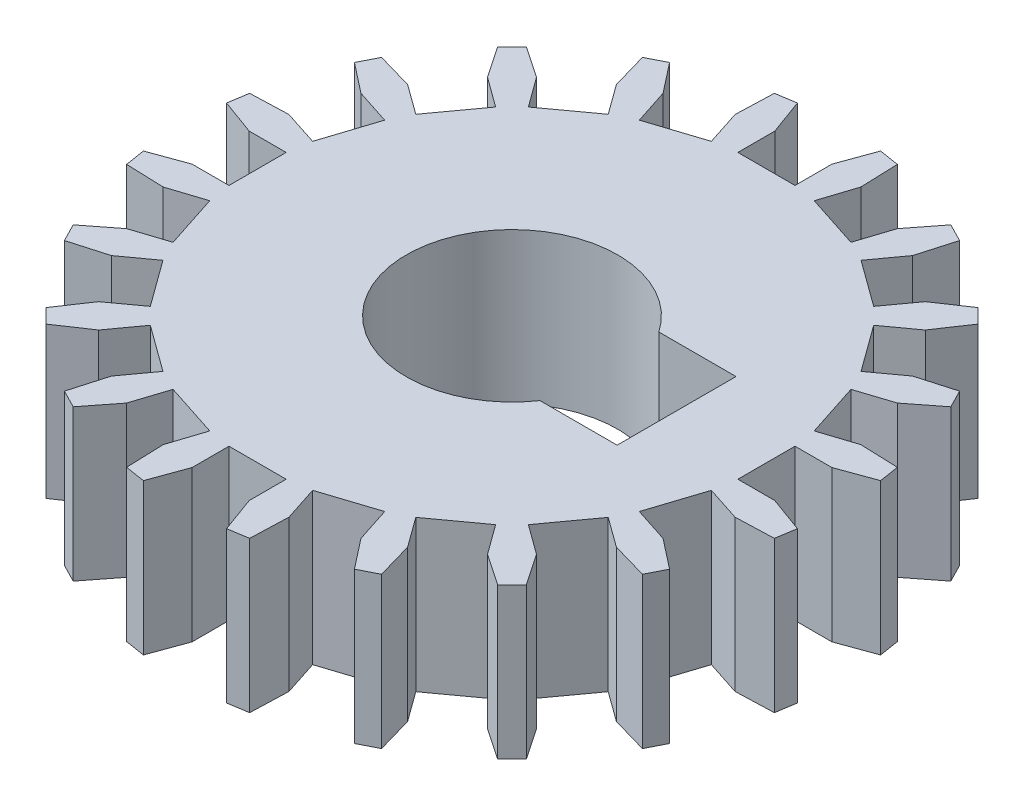
from build123d import *

# Parameters (mm, degrees)
SKETCH_1_R               = 25
EXTRUDE_1_DEPTH          = 10
CUT_EXTRUDE_1_DEPTH      = 37.742346142
PATTERN_CIRCULAR_1_COUNT = 20
CUT_EXTRUDE_2_DEPTH      = 37.334492668
PATTERN_CIRCULAR_2_COUNT = 20


with BuildPart() as part:
    # 草图1 → 凸台-拉伸1 (new body)
    with BuildSketch(Plane(origin=(0, 0, 0), x_dir=(1, 0, 0), z_dir=(0, 1, 0))):
        with Locations(Location((0, 0, 0), (0, 0, 270))):
            Circle(SKETCH_1_R)
        with BuildLine():
            Line((5.788177086, 3.936623684), (10.900331071, 3.936623684))
            Line((10.900331071, 3.936623684), (10.900331071, -3.936623684))
            Line((10.900331071, -3.936623684), (5.788177086, -3.936623684))
            ThreePointArc((5.788177086, -3.936623684), (-7, 0), (5.788177086, 3.936623684))
        make_face(mode=Mode.SUBTRACT)
    extrude(amount=EXTRUDE_1_DEPTH)

    # 草图2 → 切除-拉伸1 (cut, symmetric)
    with BuildSketch(Plane(origin=(0, 10, 0), x_dir=(1, 0, 0), z_dir=(0, 1, 0))):
        Polygon((-1.89299605, 16.850353612), (1.89299605, 16.850353612), (1.89299605, 19.294888065), (6.011008964, 30.60903556), (-6.011008964, 30.60903556), (-1.89299605, 19.294888065), align=None)
    cut_extrude_1 = extrude(amount=CUT_EXTRUDE_1_DEPTH, both=True, mode=Mode.SUBTRACT)

    # 阵列(圆周)1: 切除-拉伸1 ×20 about axis
    pattern_circular_1_axis = Axis((0, 0, 0), (0, 1, 0))
    for i in range(1, PATTERN_CIRCULAR_1_COUNT):
        add(cut_extrude_1.rotate(pattern_circular_1_axis, i * 360 / PATTERN_CIRCULAR_1_COUNT), mode=Mode.SUBTRACT)

    # 草图4 → 切除-拉伸2 (cut, symmetric)
    with BuildSketch(Plane(origin=(0, 0, 0), x_dir=(1, 0, 0), z_dir=(0, 1, 0))):
        Polygon((-5.064708137, 21.29319636), (-2.398933181, 21.715413634), (-3.215562642, 26.871409132), (-6.421705824, 26.363605939), align=None)
    cut_extrude_2 = extrude(amount=CUT_EXTRUDE_2_DEPTH, both=True, mode=Mode.SUBTRACT)

    # 阵列(圆周)2: 切除-拉伸2 ×20 about axis
    pattern_circular_2_axis = Axis((0, 0, 0), (0, 1, 0))
    for i in range(1, PATTERN_CIRCULAR_2_COUNT):
        add(cut_extrude_2.rotate(pattern_circular_2_axis, i * 360 / PATTERN_CIRCULAR_2_COUNT), mode=Mode.SUBTRACT)


solid = part.part
